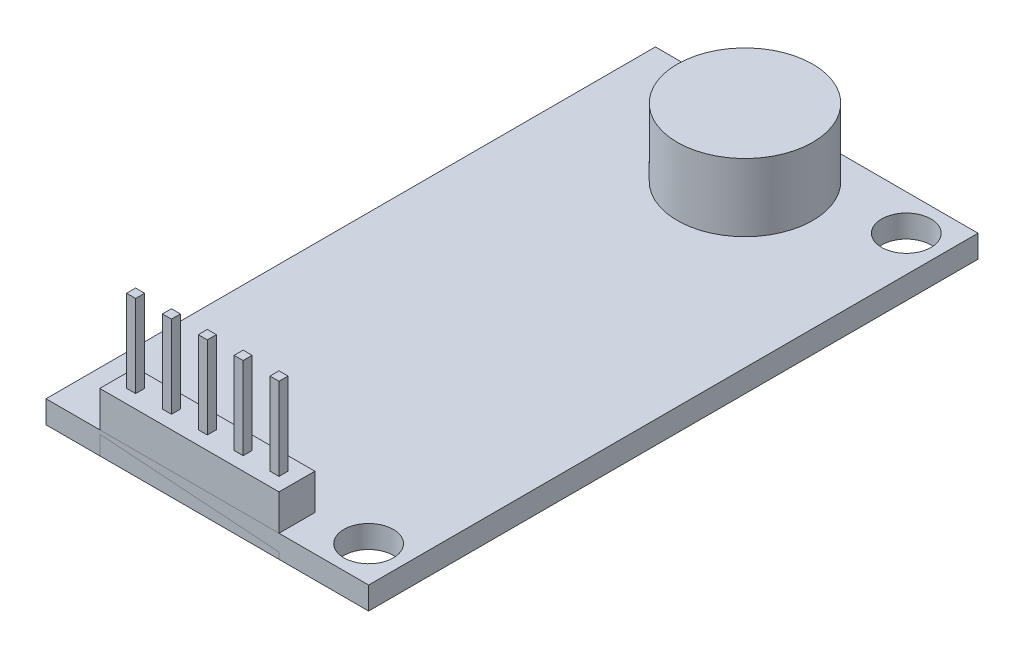
from build123d import *

# Parameters (mm, degrees)
SKETCH1_W           = 22.86
SKETCH1_H           = 43.18
BOSS_EXTRUDE1_DEPTH = 1.6
SKETCH2_W           = 0.64
SKETCH2_H           = 0.64
BOSS_EXTRUDE2_DEPTH = 8.38
SKETCH3_R           = 1.75
CUT_EXTRUDE1_DEPTH  = 1.6
SKETCH4_R           = 4.8
BOSS_EXTRUDE3_DEPTH = 4.8
SKETCH5_W           = 12.7
SKETCH5_H           = 2.54
SKETCH5_W_2         = 0.64
SKETCH5_H_2         = 0.64
BOSS_EXTRUDE4_DEPTH = 4.14


with BuildPart() as part:
    # Sketch1 → Boss-Extrude1 (new body)
    with BuildSketch(Plane(origin=(0, 0, 0), x_dir=(1, 0, 0), z_dir=(0, 1, 0))):
        Rectangle(SKETCH1_W, SKETCH1_H)
    extrude(amount=BOSS_EXTRUDE1_DEPTH)

    # Sketch2 → Boss-Extrude2 (add)
    with BuildSketch(Plane(origin=(0, 1.6, 0), x_dir=(1, 0, 0), z_dir=(0, 1, 0))):
        with Locations((-3.81, -20.32)):
            Rectangle(SKETCH2_W, SKETCH2_H)
        with Locations((-6.35, -20.32)):
            Rectangle(SKETCH2_W, SKETCH2_H)
        with Locations((-1.27, -20.32)):
            Rectangle(SKETCH2_W, SKETCH2_H)
        with Locations((1.27, -20.32)):
            Rectangle(SKETCH2_W, SKETCH2_H)
        with Locations((3.81, -20.32)):
            Rectangle(SKETCH2_W, SKETCH2_H)
    extrude(amount=BOSS_EXTRUDE2_DEPTH)

    # Sketch3 → Cut-Extrude1 (cut)
    with BuildSketch(Plane(origin=(0, 1.6, 0), x_dir=(1, 0, 0), z_dir=(0, 1, 0))):
        with Locations(Location((8.89, 19.05, 0), (0, 0, 270))):
            Circle(SKETCH3_R)
        with Locations(Location((8.89, -19.05, 0), (0, 0, 270))):
            Circle(SKETCH3_R)
    extrude(amount=-CUT_EXTRUDE1_DEPTH, mode=Mode.SUBTRACT)

    # Sketch4 → Boss-Extrude3 (add)
    with BuildSketch(Plane(origin=(0, 1.6, 0), x_dir=(1, 0, 0), z_dir=(0, 1, 0))):
        with Locations(Location((0, 16.51, 0), (0, 0, 90))):
            Circle(SKETCH4_R)
    extrude(amount=BOSS_EXTRUDE3_DEPTH)


with BuildPart() as body_2:
    # Sketch5 → Boss-Extrude4 (new body)
    with BuildSketch(Plane.XZ):
        with Locations((-1.27, 20.32)):
            Rectangle(SKETCH5_W, SKETCH5_H)
        with Locations((-1.27, 20.32)):
            Rectangle(SKETCH5_W_2, SKETCH5_H_2, mode=Mode.SUBTRACT)
    extrude(amount=-BOSS_EXTRUDE4_DEPTH)


solid = Compound([part.part, body_2.part])
